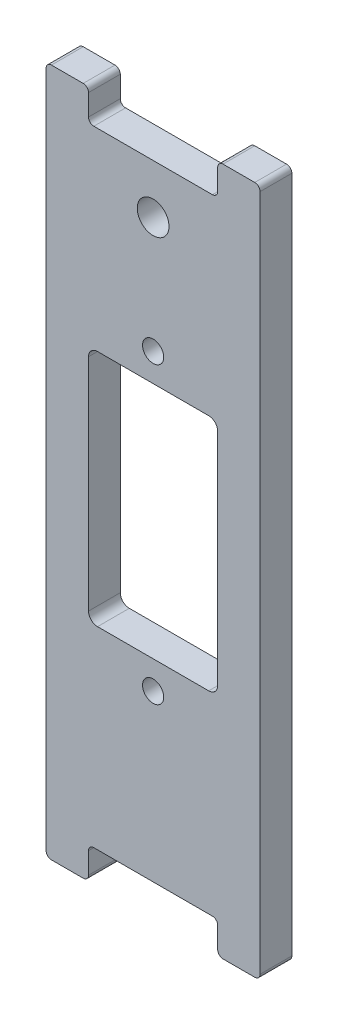
from build123d import *

# Parameters (mm, degrees)
SKETCH1_R           = 1
SKETCH1_R_2         = 1.5
BOSS_EXTRUDE1_DEPTH = 3


with BuildPart() as part:
    # Sketch1 → Boss-Extrude1 (new body)
    with BuildSketch(Plane.XY):
        with BuildLine():
            Line((5.6, -29.5), (-5.6, -29.5))
            ThreePointArc((-5.6, -29.5), (-5.953553391, -29.646446609), (-6.1, -30))
            Line((-6.1, -30), (-6.1, -32))
            ThreePointArc((-6.1, -32), (-6.246446609, -32.353553391), (-6.6, -32.5))
            Line((-6.6, -32.5), (-9.6, -32.5))
            ThreePointArc((-9.6, -32.5), (-9.953553391, -32.353553391), (-10.1, -32))
            Line((-10.1, -32), (-10.1, -22.5))
            Line((-10.1, -22.5), (-10.1, 22.5))
            Line((-10.1, 22.5), (-10.1, 32))
            ThreePointArc((-10.1, 32), (-9.953553391, 32.353553391), (-9.6, 32.5))
            Line((-9.6, 32.5), (-6.6, 32.5))
            ThreePointArc((-6.6, 32.5), (-6.246446609, 32.353553391), (-6.1, 32))
            Line((-6.1, 32), (-6.1, 30))
            ThreePointArc((-6.1, 30), (-5.953553391, 29.646446609), (-5.6, 29.5))
            Line((-5.6, 29.5), (5.6, 29.5))
            ThreePointArc((5.6, 29.5), (5.953553391, 29.646446609), (6.1, 30))
            Line((6.1, 30), (6.1, 32))
            ThreePointArc((6.1, 32), (6.246446609, 32.353553391), (6.6, 32.5))
            Line((6.6, 32.5), (9.6, 32.5))
            ThreePointArc((9.6, 32.5), (9.953553391, 32.353553391), (10.1, 32))
            Line((10.1, 32), (10.1, 22.5))
            Line((10.1, 22.5), (10.1, -22.5))
            Line((10.1, -22.5), (10.1, -32))
            ThreePointArc((10.1, -32), (9.953553391, -32.353553391), (9.6, -32.5))
            Line((9.6, -32.5), (6.6, -32.5))
            ThreePointArc((6.6, -32.5), (6.246446609, -32.353553391), (6.1, -32))
            Line((6.1, -32), (6.1, -30))
            ThreePointArc((6.1, -30), (5.953553391, -29.646446609), (5.6, -29.5))
        make_face()
        with Locations((0, 13.9)):
            Circle(SKETCH1_R, mode=Mode.SUBTRACT)
        with Locations(Location((0, -13.9, 0), (0, 0, 180))):
            Circle(SKETCH1_R, mode=Mode.SUBTRACT)
        with Locations((0, 24.85)):
            Circle(SKETCH1_R_2, mode=Mode.SUBTRACT)
        with BuildLine():
            Line((5.25, -11.25), (-5.25, -11.25))
            ThreePointArc((-5.25, -11.25), (-5.851040764, -11.001040764), (-6.1, -10.4))
            Line((-6.1, -10.4), (-6.1, 10.4))
            ThreePointArc((-6.1, 10.4), (-5.851040764, 11.001040764), (-5.25, 11.25))
            Line((-5.25, 11.25), (5.25, 11.25))
            ThreePointArc((5.25, 11.25), (5.851040764, 11.001040764), (6.1, 10.4))
            Line((6.1, 10.4), (6.1, -10.4))
            ThreePointArc((6.1, -10.4), (5.851040764, -11.001040764), (5.25, -11.25))
        make_face(mode=Mode.SUBTRACT)
    extrude(amount=BOSS_EXTRUDE1_DEPTH)


solid = part.part
